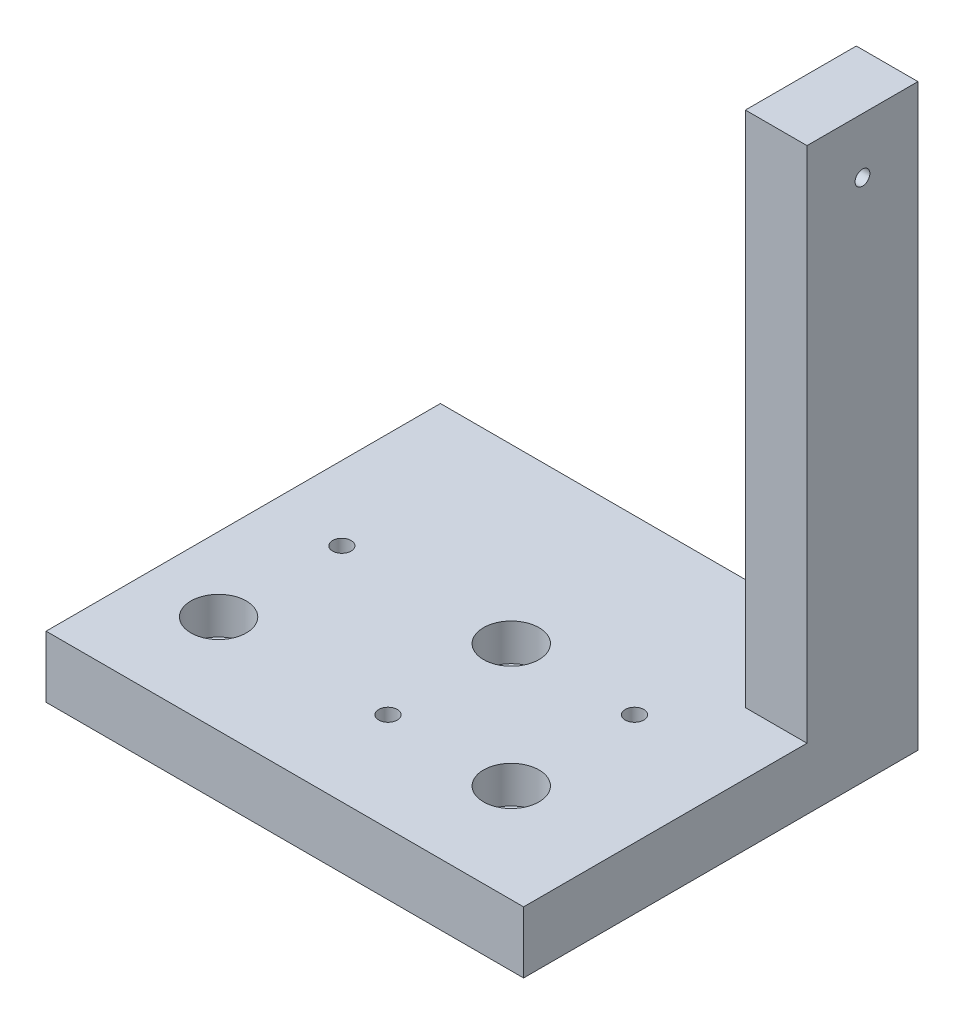
from build123d import *

# Parameters (mm, degrees)
SKETCH_1_W          = 38.75
SKETCH_1_H          = 30
EXTRUDE_1_DEPTH     = 5
SKETCH_1_15_W       = 5
SKETCH_1_15_H       = 5
EXTRUDE_2_DEPTH     = 47
SKETCH_2_R          = 0.6
CUT_EXTRUDE_1_DEPTH = 66.177162411
SKETCH_3_R          = 1.5
SKETCH_3_R_2        = 0.75
CUT_EXTRUDE_2_DEPTH = 65.541169032
SKETCH_3_3_R        = 2.25
CUT_EXTRUDE_3_DEPTH = 3
SKETCH_4_W          = 5
SKETCH_4_H          = 42
EXTRUDE_3_DEPTH     = 2
EXTRUDE_START       = -5
SKETCH_4_3_W        = 5
SKETCH_4_3_H        = 42
EXTRUDE_4_DEPTH     = 2


with BuildPart() as part:
    # 草图1 → 凸台-拉伸1 (new body)
    with BuildSketch(Plane(origin=(0, 0, 0), x_dir=(1, 0, 0), z_dir=(0, 1, 0))):
        with Locations((-19.375, 15)):
            Rectangle(SKETCH_1_W, SKETCH_1_H)
    extrude(amount=EXTRUDE_1_DEPTH)

    # 草图1<15> → 凸台-拉伸2 (add)
    with BuildSketch(Plane(origin=(0, 0, 0), x_dir=(1, 0, 0), z_dir=(0, 1, 0))):
        with Locations((-2.5, 27.5)):
            Rectangle(SKETCH_1_15_W, SKETCH_1_15_H)
    extrude(amount=EXTRUDE_2_DEPTH)

    # 草图2 → 切除-拉伸1 (cut, through all)
    with BuildSketch(Plane.ZY.offset(5)):
        with Locations((-27.5, 42.5)):
            Circle(SKETCH_2_R)
    extrude(amount=-CUT_EXTRUDE_1_DEPTH, mode=Mode.SUBTRACT)

    # 草图3 → 切除-拉伸2 (cut, through all)
    with BuildSketch(Plane(origin=(0, 5, 0), x_dir=(1, 0, 0), z_dir=(0, 1, 0))):
        with Locations(Location((-9, 8, 0), (0, 0, 270))):
            Circle(SKETCH_3_R)
        with Locations(Location((-32.75, 8, 0), (0, 0, 270))):
            Circle(SKETCH_3_R)
        with Locations(Location((-19, 18, 0), (0, 0, 270))):
            Circle(SKETCH_3_R)
        with Locations(Location((-32.75, 18, 0), (0, 0, 270))):
            Circle(SKETCH_3_R_2)
        with Locations(Location((-9, 18, 0), (0, 0, 270))):
            Circle(SKETCH_3_R_2)
        with Locations(Location((-19, 8, 0), (0, 0, 270))):
            Circle(SKETCH_3_R_2)
    extrude(amount=-CUT_EXTRUDE_2_DEPTH, mode=Mode.SUBTRACT)

    # 草图3<3> → 切除-拉伸3 (cut)
    with BuildSketch(Plane(origin=(0, 5, 0), x_dir=(1, 0, 0), z_dir=(0, 1, 0))):
        with Locations(Location((-19, 18, 0), (0, 0, 270))):
            Circle(SKETCH_3_3_R)
        with Locations(Location((-32.75, 8, 0), (0, 0, 270))):
            Circle(SKETCH_3_3_R)
        with Locations(Location((-9, 8, 0), (0, 0, 270))):
            Circle(SKETCH_3_3_R)
    extrude(amount=-CUT_EXTRUDE_3_DEPTH, mode=Mode.SUBTRACT)

    # 草图4 → 凸台-拉伸3 (add)
    with BuildSketch(Plane.XY.offset(-25)):
        with Locations((-2.5, 26)):
            Rectangle(SKETCH_4_W, SKETCH_4_H)
    extrude(amount=EXTRUDE_3_DEPTH)

    # 草图4<3> → 凸台-拉伸4 (add)
    with BuildSketch(Plane.XY.offset(-25).offset(EXTRUDE_START)):
        with Locations((-2.5, 26)):
            Rectangle(SKETCH_4_3_W, SKETCH_4_3_H)
        Polygon((0, 0), (0, 5), (-5, 5), (-38.75, 5), (-38.75, 0), align=None)
    extrude(amount=-EXTRUDE_4_DEPTH)


solid = part.part
